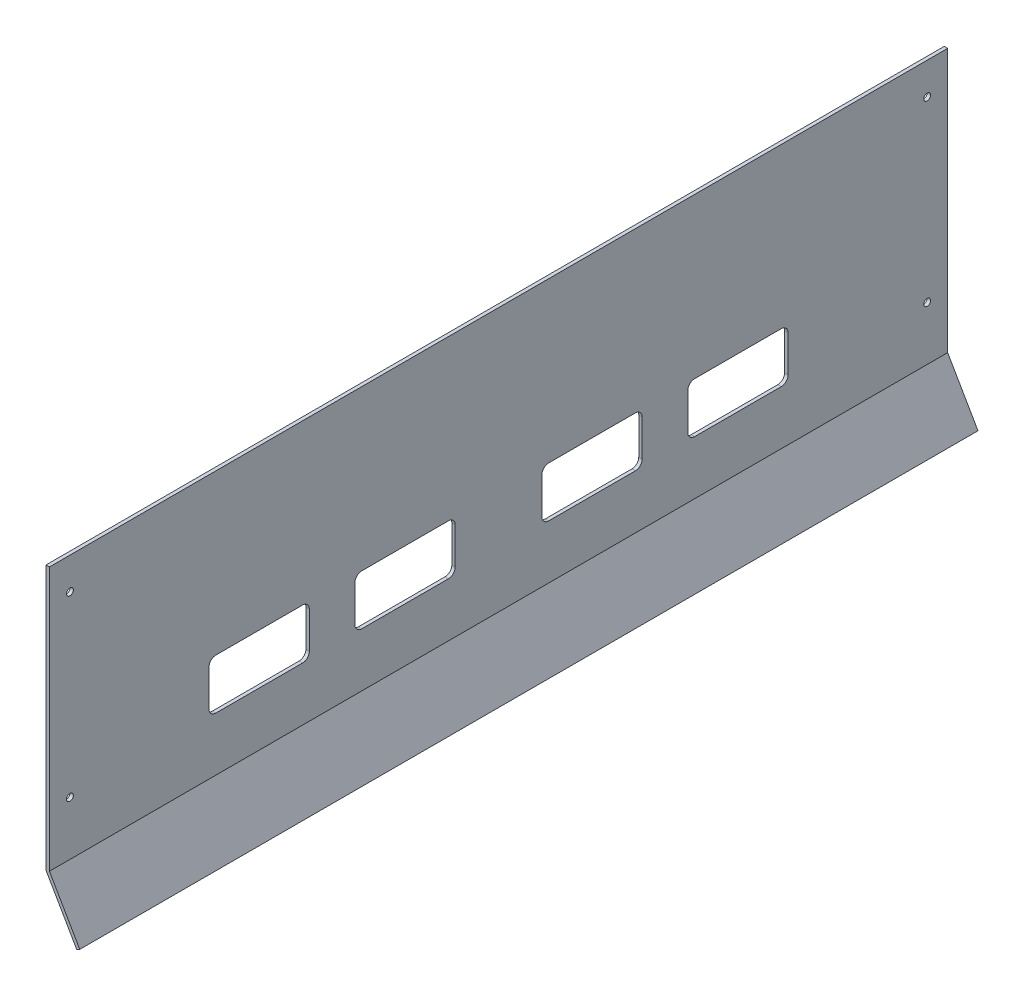
from build123d import *

# Parameters (mm, degrees)
EXTRUDE_1_DEPTH     = 394
SKETCH_2_R          = 1.5
SKETCH_2_W          = 44
SKETCH_2_H          = 22
CUT_EXTRUDE_1_DEPTH = 411.987848396
FILLET_1_R          = 3


with BuildPart() as part:
    # 草图1 → 凸台-拉伸1 (new body)
    with BuildSketch(Plane.XY):
        Polygon((0, 0), (0, 116), (1.5, 116), (1.5, 0.401923789), (14.799038106, -22.632685902), (13.5, -23.382685902), align=None)
    extrude(amount=EXTRUDE_1_DEPTH)

    # 草图2 → 切除-拉伸1 (cut, through all)
    with BuildSketch(Plane.ZY):
        with Locations((385, 24)):
            Circle(SKETCH_2_R)
        with Locations((385, 102)):
            Circle(SKETCH_2_R)
        with Locations((9, 102)):
            Circle(SKETCH_2_R)
        with Locations((9, 24)):
            Circle(SKETCH_2_R)
        with Locations((156, 35)):
            Rectangle(SKETCH_2_W, SKETCH_2_H)
        with Locations((238, 35)):
            Rectangle(SKETCH_2_W, SKETCH_2_H)
        with Locations((302, 35)):
            Rectangle(SKETCH_2_W, SKETCH_2_H)
        with Locations((92, 35)):
            Rectangle(SKETCH_2_W, SKETCH_2_H)
    extrude(amount=-CUT_EXTRUDE_1_DEPTH, mode=Mode.SUBTRACT)

    # 圆角1
    fillet_1_edges = [part.edges().sort_by_distance(p)[0] for p in [
        (0.75, 24, 216),
        (0.75, 46, 216),
        (0.75, 46, 260),
        (0.75, 24, 260),
        (0.75, 24, 280),
        (0.75, 46, 280),
        (0.75, 46, 324),
        (0.75, 24, 324),
        (0.75, 46, 178),
        (0.75, 24, 178),
        (0.75, 24, 134),
        (0.75, 46, 134),
        (0.75, 46, 70),
        (0.75, 46, 114),
        (0.75, 24, 114),
        (0.75, 24, 70),
    ]]
    fillet(fillet_1_edges, radius=FILLET_1_R)


solid = part.part
